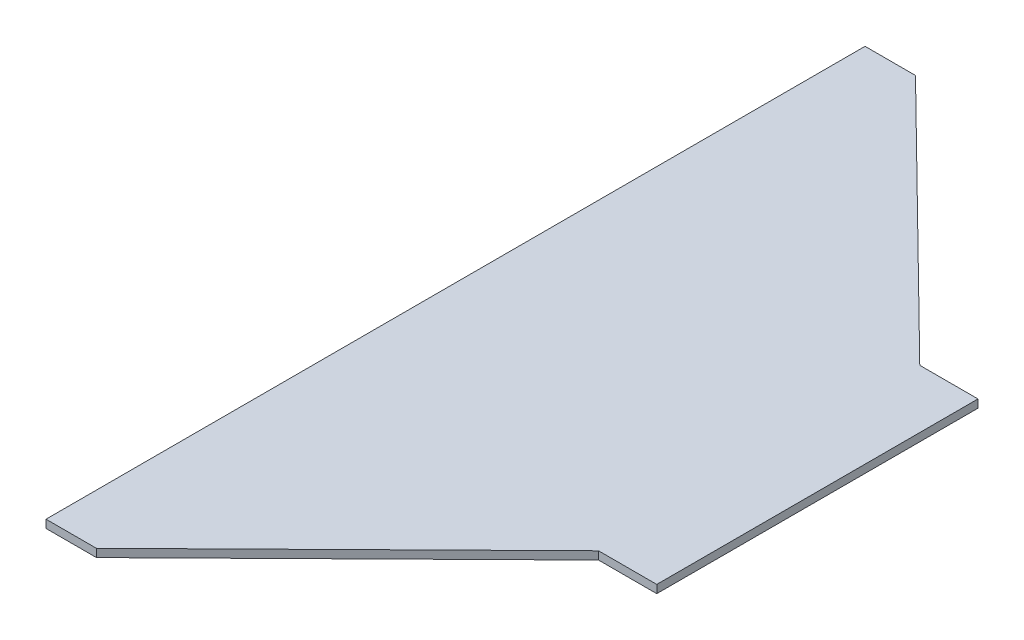
from build123d import *

# Parameters (mm, degrees)
SALIENTE_EXTRUIR1_DEPTH = 1


with BuildPart() as part:
    # Croquis1 → Saliente-Extruir1 (new body)
    with BuildSketch(Plane(origin=(0, 0, 0), x_dir=(1, 0, 0), z_dir=(0, 1, 0))):
        Polygon((0, 0), (0, -101.83), (6.27, -101.83), (37.748869018, -70.885), (44.988869018, -70.885), (44.988869018, -30.945), (37.748869018, -30.945), (6.27, 0), align=None)
    extrude(amount=SALIENTE_EXTRUIR1_DEPTH)


solid = part.part
